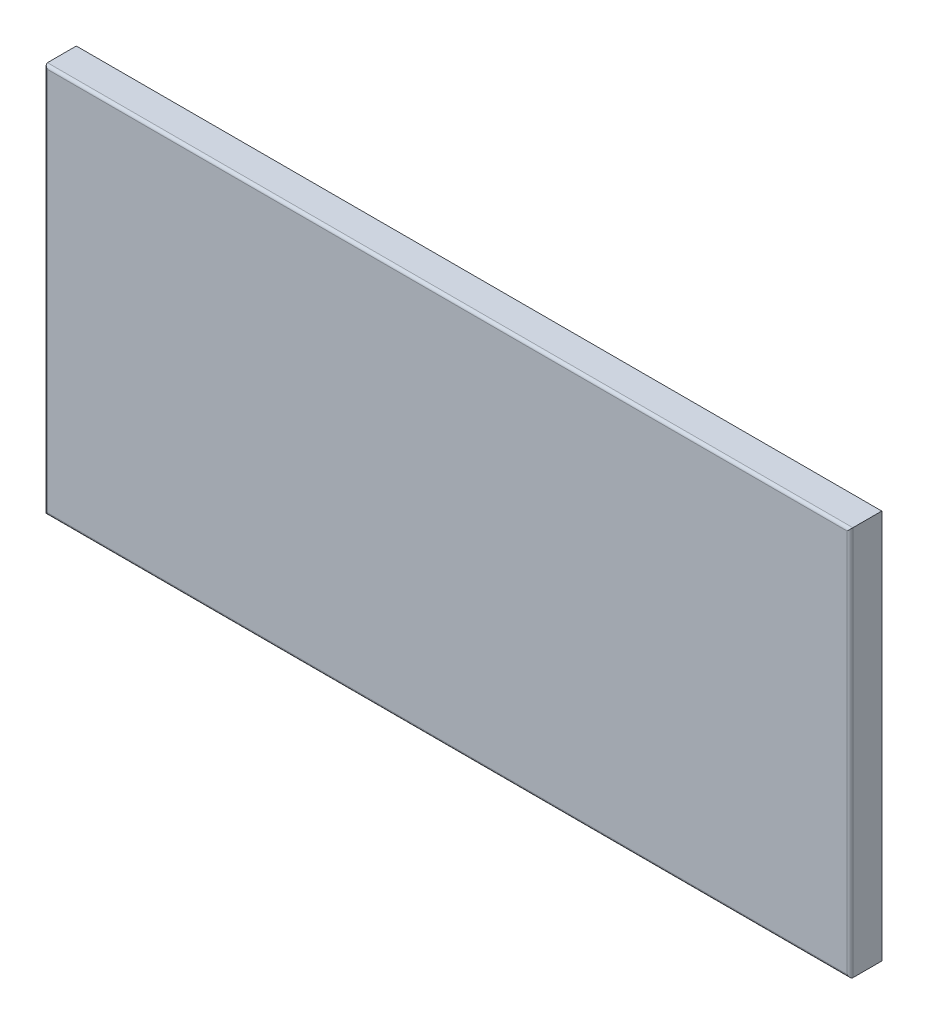
from build123d import *

# Parameters (mm, degrees)
ESQUISSE1_W        = 27.9
ESQUISSE1_H        = 13.5
BOSS_EXTRU_1_DEPTH = 1.1
CONG_1_R           = 0.1


with BuildPart() as part:
    # Esquisse1 → Boss.-Extru.1 (new body)
    with BuildSketch(Plane.XY):
        with Locations((13.95, 6.75)):
            Rectangle(ESQUISSE1_W, ESQUISSE1_H)
    extrude(amount=BOSS_EXTRU_1_DEPTH)

    # Congé1
    cong_1_edges = [part.edges().sort_by_distance(p)[0] for p in [
        (27.9, 6.75, 1.1),
        (13.95, 13.5, 1.1),
        (0, 6.75, 1.1),
        (13.95, 0, 1.1),
    ]]
    fillet(cong_1_edges, radius=CONG_1_R)


solid = part.part
